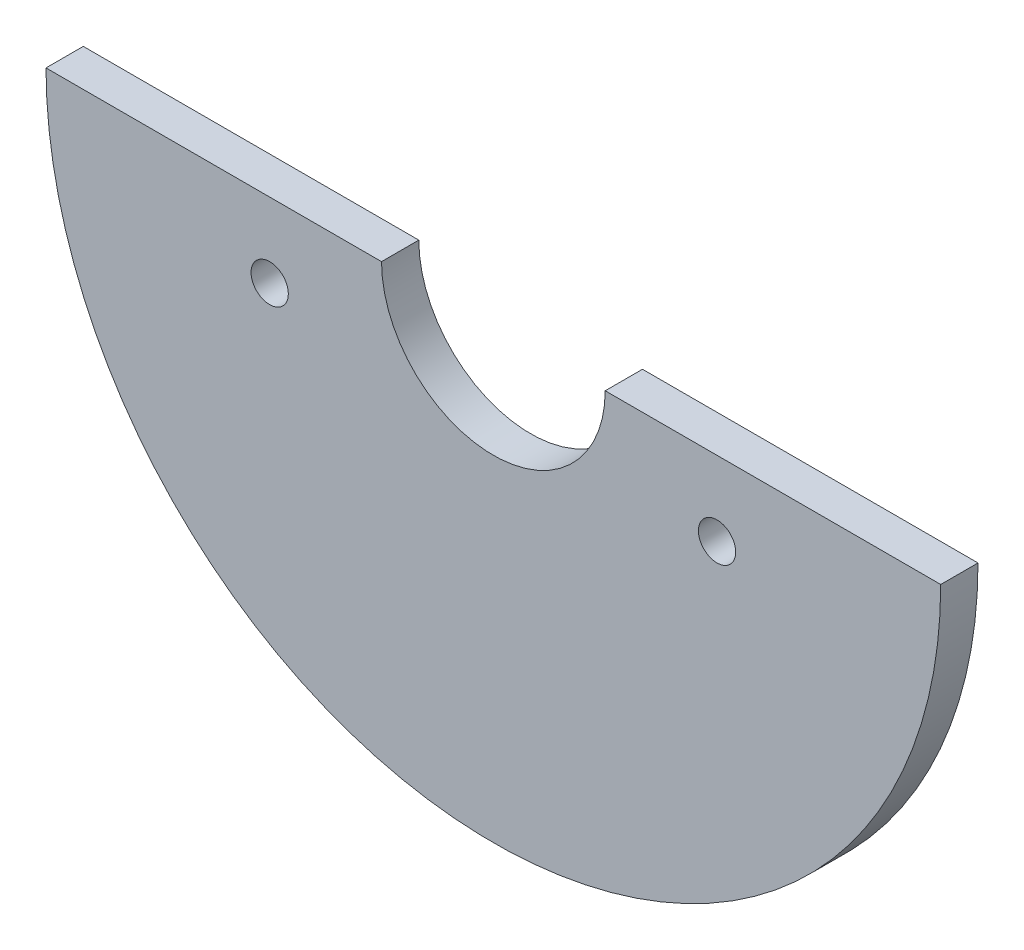
from build123d import *

# Parameters (mm, degrees)
SKETCH1_R           = 2.5
BOSS_EXTRUDE1_DEPTH = 5


with BuildPart() as part:
    # Sketch1 → Boss-Extrude1 (new body)
    with BuildSketch(Plane.XY):
        with BuildLine():
            Line((-60, 0), (-15, 0))
            ThreePointArc((-15, 0), (0, -15), (15, 0))
            Line((15, 0), (60, 0))
            ThreePointArc((60, 0), (0, -60), (-60, 0))
        make_face()
        with Locations((30, -10)):
            Circle(SKETCH1_R, mode=Mode.SUBTRACT)
        with Locations((-30, -10)):
            Circle(SKETCH1_R, mode=Mode.SUBTRACT)
    extrude(amount=BOSS_EXTRUDE1_DEPTH)


solid = part.part
